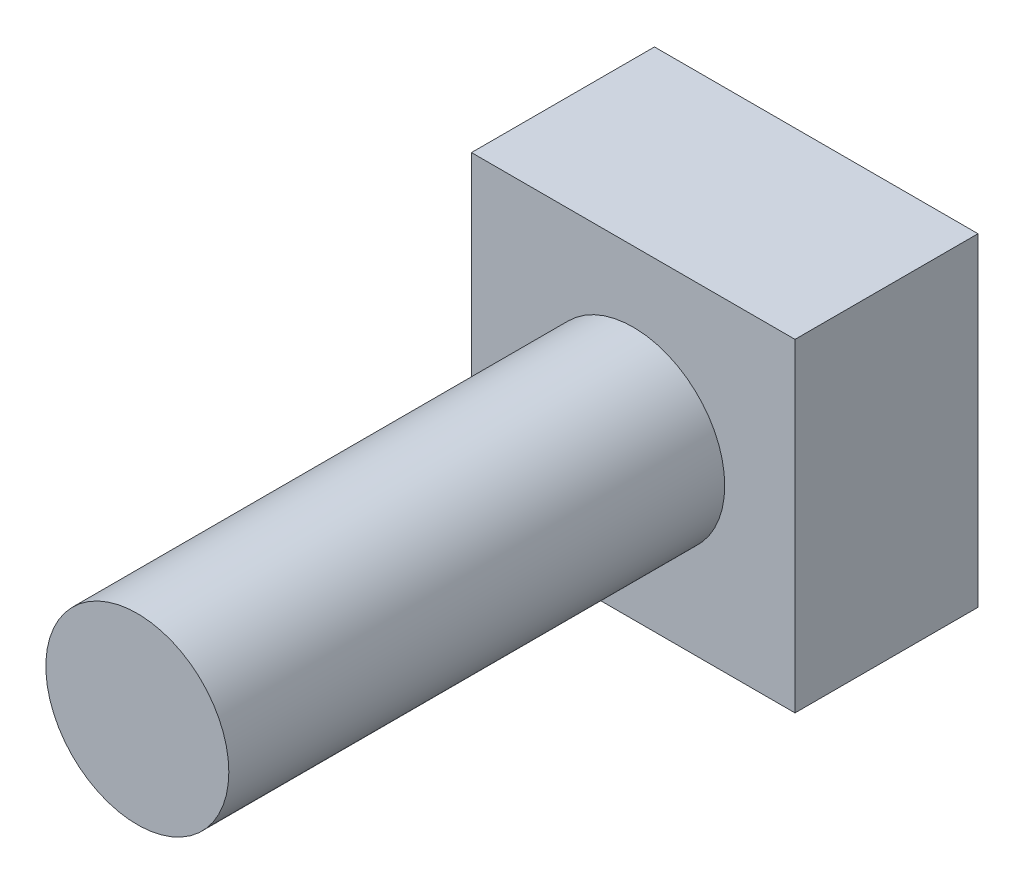
from build123d import *

# Parameters (mm, degrees)
SKETCH1_W           = 6.1976
SKETCH1_H           = 6.1976
BOSS_EXTRUDE1_DEPTH = 3.5052
SKETCH2_R           = 1.7526
BOSS_EXTRUDE2_DEPTH = 9.4996


with BuildPart() as part:
    # Sketch1 → Boss-Extrude1 (new body)
    with BuildSketch(Plane.XY):
        Rectangle(SKETCH1_W, SKETCH1_H)
    extrude(amount=-BOSS_EXTRUDE1_DEPTH)

    # Sketch2 → Boss-Extrude2 (add)
    with BuildSketch(Plane.XY):
        Circle(SKETCH2_R)
    extrude(amount=BOSS_EXTRUDE2_DEPTH)


solid = part.part
